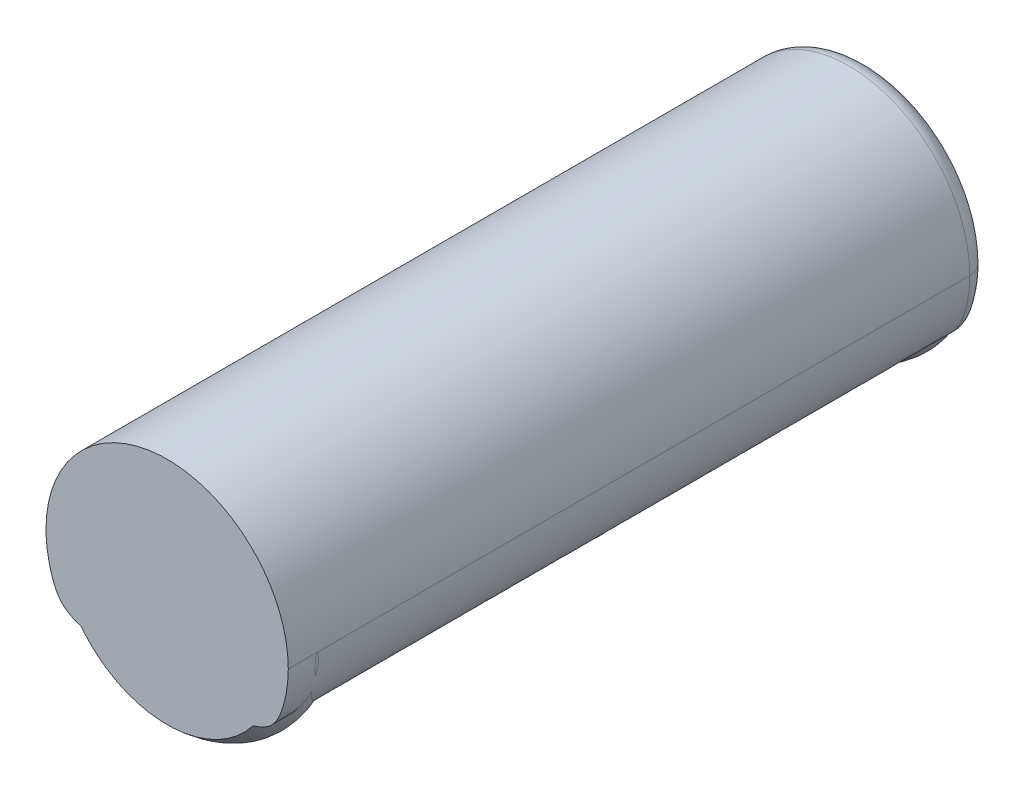
from build123d import *

# Parameters (mm, degrees)
REVOLVE1_ANGLE      = 180
BOSS_EXTRUDE1_DEPTH = 90.001129
BOSS_EXTRUDE3_DEPTH = 90.001129
FILLET1_R           = 2.54


with BuildPart() as part:
    # Sketch1 → Revolve1 (revolve, symmetric)
    with BuildSketch(Plane(origin=(0, 0, 0), x_dir=(0, 0, -1), z_dir=(1, 0, 0))) as revolve1_sk:
        with BuildLine():
            add(Edge.make_bspline(
                [(88.9, -13.97), (83.822341514, -17.620502793), (77.211297424, -6.83743518), (68.760471334, -14.749850942), (61.010920861, -14.848844861), (54.642333542, -8.531552039), (48.059060287, -14.794393159), (40.349847963, -14.965712056), (34.222685551, -8.513496882), (27.778431864, -14.822071343), (20.025586864, -14.80765679), (11.419045009, -6.455402252), (4.487965869, -18.937566239), (-1.101129269, -13.97)],
                knots=[0, 0, 0, 0, 0.148511914, 0.232302924, 0.300118398, 0.378852331, 0.46264334, 0.532682273, 0.606431362, 0.690222371, 0.758037846, 0.837777852, 1, 1, 1, 1], degree=3))
            Line((-1.101129269, -13.97), (-1.101129269, 0))
            Line((-1.101129269, 0), (88.9, 0))
            Line((88.9, 0), (88.9, -13.97))
        make_face()
    revolve(axis=Axis((0, 0, 0), (0, 0, -1)), revolution_arc=REVOLVE1_ANGLE / 2)
    revolve(revolve1_sk.sketch, axis=Axis((0, 0, 0), (0, 0, 1)), revolution_arc=REVOLVE1_ANGLE / 2)

    # Sketch2 → Boss-Extrude1 (add)
    with BuildSketch(Plane(origin=(0, 0, -88.9), x_dir=(-1, 0, 0), z_dir=(0, 0, -1))):
        with BuildLine():
            Line((-15.547385191, 0), (15.547385191, 0))
            ThreePointArc((15.547385191, 0), (0, 15.547385191), (-15.547385191, 0))
        make_face()
    extrude(amount=-BOSS_EXTRUDE1_DEPTH)

    # Sketch4 → Boss-Extrude3 (add)
    with BuildSketch(Plane(origin=(0, 0, -88.9), x_dir=(-1, 0, 0), z_dir=(0, 0, -1))):
        with BuildLine():
            Line((-15.547385191, 0), (15.547385191, 0))
            add(Edge.make_bspline(
                [(15.547385191, 0), (15.532934624, -1.623218456), (15.179691191, -4.086350784), (13.745944181, -7.454814655), (9.712119631, -9.34253419), (5.041906981, -8.703059826), (1.36283746, -8.852160986), (0, -8.852160986)],
                knots=[0, 0, 0, 0, 0.222161565, 0.356740334, 0.485157361, 0.808535757, 1, 1, 1, 1], degree=3))
            add(Edge.make_bspline(
                [(-15.547385191, 0), (-15.532934624, -1.623218456), (-15.179691191, -4.086350784), (-13.745944181, -7.454814655), (-9.712119631, -9.34253419), (-5.041906981, -8.703059826), (-1.36283746, -8.852160986), (0, -8.852160986)],
                knots=[0, 0, 0, 0, 0.222161565, 0.356740334, 0.485157361, 0.808535757, 1, 1, 1, 1], degree=3))
        make_face()
    extrude(amount=-BOSS_EXTRUDE3_DEPTH)

    # Fillet1
    fillet1_edges = [part.edges().sort_by_distance(p)[0] for p in [
        (-14.672348717, -5.135779191, -88.9),
        (14.672348717, -5.135779191, -88.9),
        (6.146638834, -12.545107853, -88.9),
        (0, 15.547385191, -88.9),
    ]]
    fillet(fillet1_edges, radius=FILLET1_R)


solid = part.part
